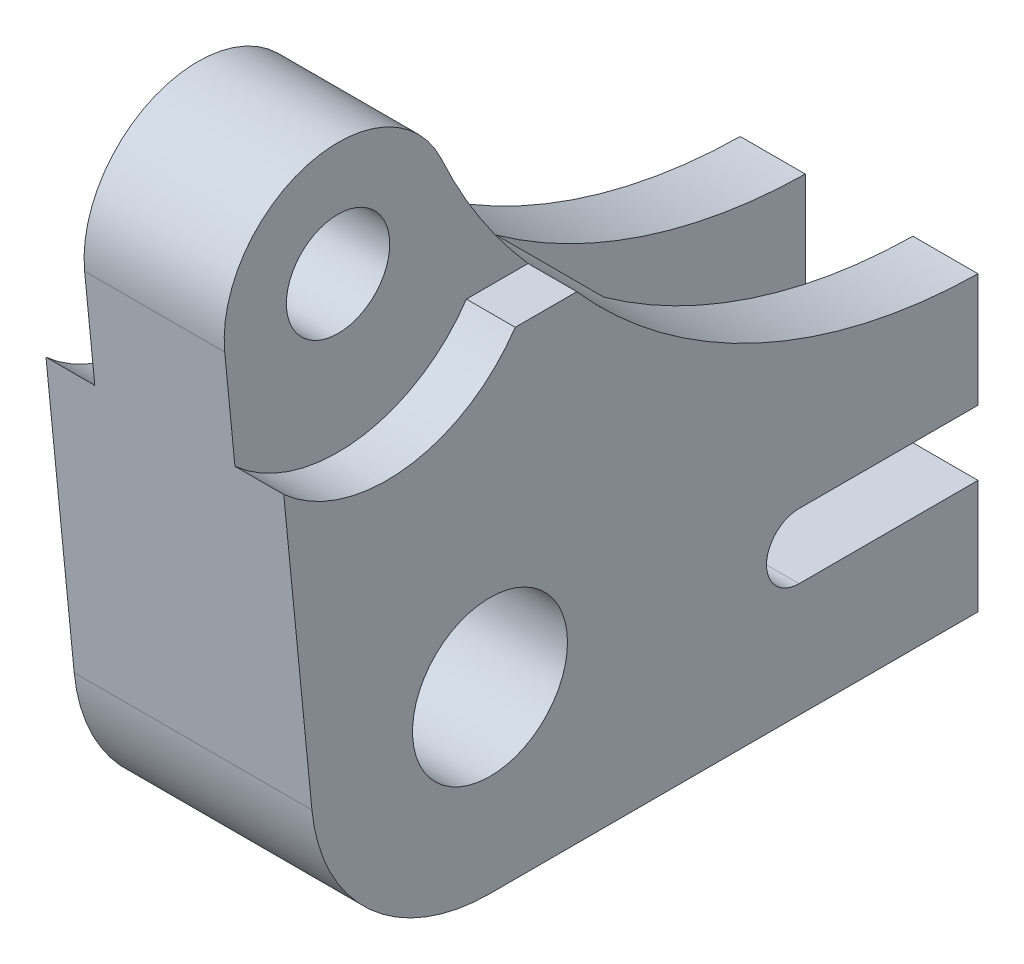
from build123d import *

# Parameters (mm, degrees)
SKETCH1_R           = 6.35
SKETCH1_R_2         = 9.525
BOSS_EXTRUDE1_DEPTH = 14.615
CUT_EXTRUDE1_DEPTH  = 91.641086881
SKETCH4_W           = 13.23
SKETCH4_H           = 38
CUT_EXTRUDE2_DEPTH  = 104.718600248
CUT_EXTRUDE3_DEPTH  = 6


with BuildPart() as part:
    # Sketch1 → Boss-Extrude1 (new, symmetric)
    with BuildSketch(Plane(origin=(0, 0, 0), x_dir=(0, 0, -1), z_dir=(1, 0, 0))):
        with BuildLine():
            Line((0, -22), (60, -22))
            Line((60, -22), (60, 14))
            ThreePointArc((60, 14), (24.306087072, 24.928324713), (0, 53.260247211))
            ThreePointArc((0, 53.260247211), (-16.383810232, 60.832127863), (-26.61523279, 45.963348263))
            Line((-26.61523279, 45.963348263), (-21.894870769, -2.148169925))
            ThreePointArc((-21.894870769, -2.148169925), (-14.777351956, -16.298155392), (0, -22))
        make_face()
        with Locations((-12.68213321, 47.330365488)):
            Circle(SKETCH1_R, mode=Mode.SUBTRACT)
        Circle(SKETCH1_R_2, mode=Mode.SUBTRACT)
    extrude(amount=BOSS_EXTRUDE1_DEPTH, both=True)

    # Sketch2 → Cut-Extrude1 (cut, through all)
    with BuildSketch(Plane(origin=(14.615, 0, 0), x_dir=(0, 0, -1), z_dir=(1, 0, 0))):
        with BuildLine():
            Line((38, 0), (60, 0))
            ThreePointArc((60, 0), (64, -4), (60, -8))
            Line((60, -8), (38, -8))
            ThreePointArc((38, -8), (34, -4), (38, 0))
        make_face()
    extrude(amount=-CUT_EXTRUDE1_DEPTH, mode=Mode.SUBTRACT)

    # Sketch4 → Cut-Extrude2 (cut, through all)
    with BuildSketch(Plane.XZ.offset(22)):
        with Locations((0, -41)):
            Rectangle(SKETCH4_W, SKETCH4_H)
    extrude(amount=-CUT_EXTRUDE2_DEPTH, mode=Mode.SUBTRACT)

    # Sketch5 → Cut-Extrude3 (cut)
    with BuildSketch(Plane(origin=(14.615, 0, 0), x_dir=(0, 0, -1), z_dir=(1, 0, 0))):
        with BuildLine():
            Line((3.099615742, 36.750365488), (10.675895531, 36.750365488))
            ThreePointArc((10.675895531, 36.750365488), (4.729057579, 44.611575605), (0, 53.260247211))
            ThreePointArc((0, 53.260247211), (-16.383810232, 60.832127863), (-26.61523279, 45.963348263))
            Line((-26.61523279, 45.963348263), (-25.360971776, 33.179497931))
            ThreePointArc((-25.360971776, 33.179497931), (-10.316803002, 28.478171637), (3.099615742, 36.750365488))
        make_face()
    cut_extrude3 = extrude(amount=-CUT_EXTRUDE3_DEPTH, mode=Mode.SUBTRACT)

    # Mirror1: Cut-Extrude3 across plane
    add(cut_extrude3.mirror(Plane(origin=(0, 0, 0), x_dir=(0, 0, 1), z_dir=(1, 0, 0))), mode=Mode.SUBTRACT)


solid = part.part
